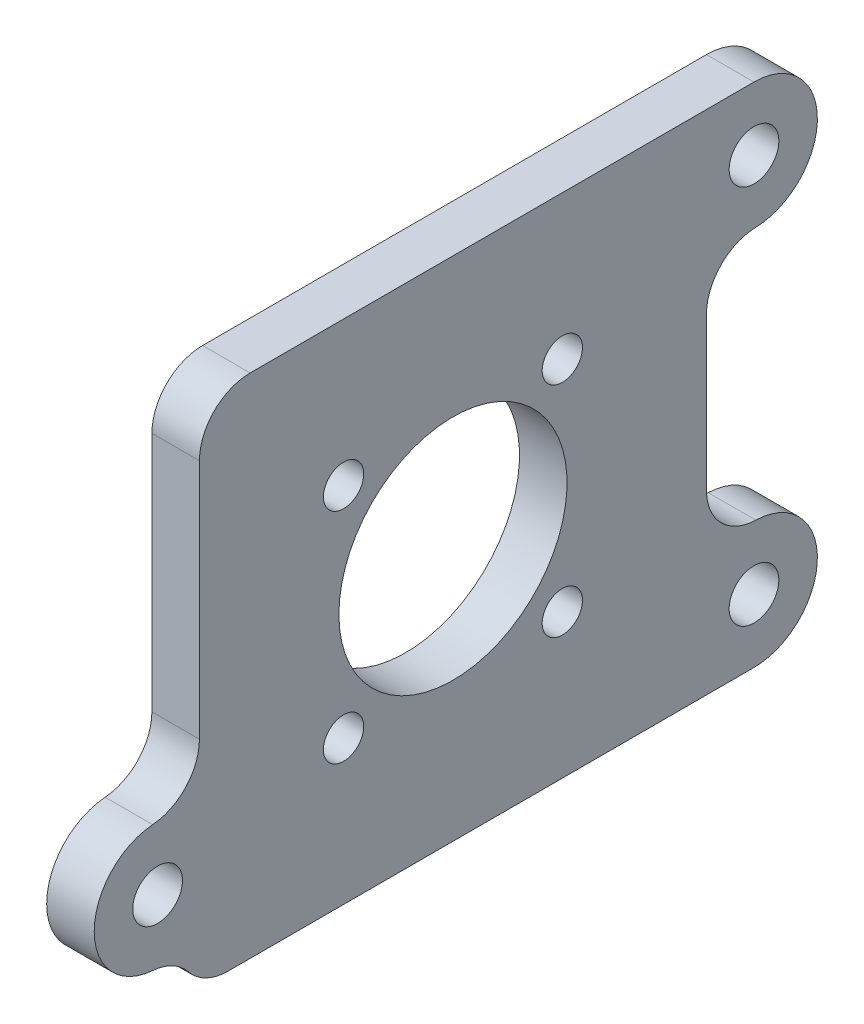
from build123d import *

# Parameters (mm, degrees)
SKETCH1_R                                         = 11.43
BOSS_EXTRUDE1_DEPTH                               = 4.7625
F_10_32_TAPPED_HOLE1_D                            = 4.0386
F_10_CLEARANCE_HOLE1_D                            = 4.9784
FILLET1_R                                         = 5.08
CSK_FOR_6_FLAT_HEAD_MACHINE_SCREW_100_D           = 3.7973
CSK_FOR_6_FLAT_HEAD_MACHINE_SCREW_100_CSINK_D     = 7.0866
CSK_FOR_6_FLAT_HEAD_MACHINE_SCREW_100_CSINK_ANGLE = 100


with BuildPart() as part:
    # Sketch1 → Boss-Extrude1 (new body)
    with BuildSketch(Plane(origin=(0, 0, 0), x_dir=(0, 0, -1), z_dir=(1, 0, 0))):
        with BuildLine():
            Line((-25.4, 25.4), (-25.4, -3.844624666))
            ThreePointArc((-25.4, -3.844624666), (-26.750820168, -7.294206927), (-30.084888889, -8.909235926))
            ThreePointArc((-30.084888889, -8.909235926), (-35.941, -15.24), (-30.084888889, -21.570764074))
            ThreePointArc((-30.084888889, -21.570764074), (-27.201538941, -22.75489945), (-25.552500859, -25.4))
            Line((-25.552500859, -25.4), (-25.4, -25.4))
            Line((-25.4, -25.4), (25.4, -25.4))
            Line((25.4, -25.4), (30.1625, -25.4))
            ThreePointArc((30.1625, -25.4), (36.511887391, -19.138202954), (30.338888889, -12.702450318))
            ThreePointArc((30.338888889, -12.702450318), (26.83834897, -11.166271352), (25.4, -7.624410573))
            Line((25.4, -7.624410573), (25.4, 7.624410573))
            ThreePointArc((25.4, 7.624410573), (26.83834897, 11.166271352), (30.338888889, 12.702450318))
            ThreePointArc((30.338888889, 12.702450318), (36.511887391, 19.138202954), (30.1625, 25.4))
            Line((30.1625, 25.4), (25.4, 25.4))
            Line((25.4, 25.4), (-25.4, 25.4))
        make_face()
        with Locations(Location((0, 0, 0), (0, 0, 180))):
            Circle(SKETCH1_R, mode=Mode.SUBTRACT)
    extrude(amount=BOSS_EXTRUDE1_DEPTH)

    # #10-32 Tapped Hole1 (through all)
    with Locations(Plane(origin=(4.7625, 0, 0), x_dir=(0, 0, -1), z_dir=(1, 0, 0))):
        with Locations((-10.9601, 10.9601), (-10.9601, -10.9601), (10.9601, -10.9601), (10.9601, 10.9601)):
            Hole(F_10_32_TAPPED_HOLE1_D / 2)

    # #10 Clearance Hole1 (through all)
    with Locations(Plane(origin=(4.7625, 0, 0), x_dir=(0, 0, -1), z_dir=(1, 0, 0))):
        with Locations((-29.591, -15.24), (30.1625, 19.05), (30.1625, -19.05)):
            Hole(F_10_CLEARANCE_HOLE1_D / 2)

    # Fillet1
    fillet1_edges = [part.edges().sort_by_distance(p)[0] for p in [
        (2.38125, -25.4, 25.552500859),
        (2.38125, 25.4, 25.4),
    ]]
    fillet(fillet1_edges, radius=FILLET1_R)

    # CSK for #6 Flat Head Machine Screw (100)1 (through all)
    with Locations(Plane(origin=(0, 10.9601, 10.9601), x_dir=(0, 0, -1), z_dir=(-1, 0, 0))):
        with Locations((0, 0), (0, 21.9202), (21.9202, 21.9202), (21.9202, 0)):
            CounterSinkHole(CSK_FOR_6_FLAT_HEAD_MACHINE_SCREW_100_D / 2, CSK_FOR_6_FLAT_HEAD_MACHINE_SCREW_100_CSINK_D / 2, counter_sink_angle=CSK_FOR_6_FLAT_HEAD_MACHINE_SCREW_100_CSINK_ANGLE)


solid = part.part
